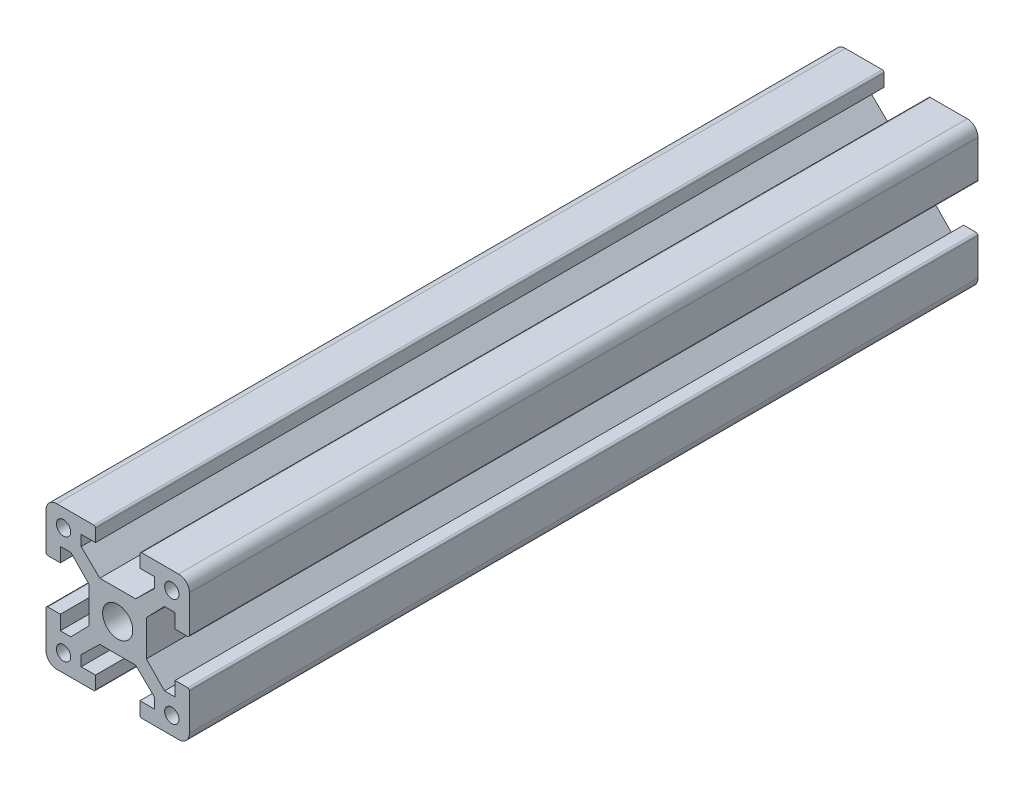
from build123d import *

# Parameters (mm, degrees)
SKETCH1_R           = 1
SKETCH1_R_2         = 2.1
BOSS_EXTRUDE2_DEPTH = 110


with BuildPart() as part:
    # Sketch1 → Boss-Extrude2 (new body)
    with BuildSketch(Plane.XY):
        with BuildLine():
            Line((-6.4, -1.5), (-6.4, -6.65))
            ThreePointArc((-6.4, -6.65), (-6.326776695, -6.826776695), (-6.15, -6.9))
            Line((-6.15, -6.9), (-4.4, -6.9))
            Line((-4.4, -6.9), (-4.4, -4.9))
            Line((-4.4, -4.9), (-2.927777778, -4.9))
            Line((-2.927777778, -4.9), (-0.4, -7.5))
            Line((-0.4, -7.5), (-0.4, -12.5))
            Line((-0.4, -12.5), (-2.927777778, -15.1))
            Line((-2.927777778, -15.1), (-4.4, -15.1))
            Line((-4.4, -15.1), (-4.4, -13.1))
            Line((-4.4, -13.1), (-6.15, -13.1))
            ThreePointArc((-6.15, -13.1), (-6.326776695, -13.173223305), (-6.4, -13.35))
            Line((-6.4, -13.35), (-6.4, -18.5))
            ThreePointArc((-6.4, -18.5), (-5.960660172, -19.560660172), (-4.9, -20))
            Line((-4.9, -20), (0.25, -20))
            ThreePointArc((0.25, -20), (0.426776695, -19.926776695), (0.5, -19.75))
            Line((0.5, -19.75), (0.5, -18))
            Line((0.5, -18), (-1.5, -18))
            Line((-1.5, -18), (-1.5, -16.527777778))
            Line((-1.5, -16.527777778), (1.1, -14))
            Line((1.1, -14), (6.1, -14))
            Line((6.1, -14), (8.7, -16.527777778))
            Line((8.7, -16.527777778), (8.7, -18))
            Line((8.7, -18), (6.7, -18))
            Line((6.7, -18), (6.7, -19.75))
            ThreePointArc((6.7, -19.75), (6.773223305, -19.926776695), (6.95, -20))
            Line((6.95, -20), (12.1, -20))
            ThreePointArc((12.1, -20), (13.160660172, -19.560660172), (13.6, -18.5))
            Line((13.6, -18.5), (13.6, -13.35))
            ThreePointArc((13.6, -13.35), (13.526776695, -13.173223305), (13.35, -13.1))
            Line((13.35, -13.1), (11.6, -13.1))
            Line((11.6, -13.1), (11.6, -15.1))
            Line((11.6, -15.1), (10.127777778, -15.1))
            Line((10.127777778, -15.1), (7.6, -12.5))
            Line((7.6, -12.5), (7.6, -7.5))
            Line((7.6, -7.5), (10.127777778, -4.9))
            Line((10.127777778, -4.9), (11.6, -4.9))
            Line((11.6, -4.9), (11.6, -6.9))
            Line((11.6, -6.9), (13.35, -6.9))
            ThreePointArc((13.35, -6.9), (13.526776695, -6.826776695), (13.6, -6.65))
            Line((13.6, -6.65), (13.6, -1.5))
            ThreePointArc((13.6, -1.5), (13.160660172, -0.439339828), (12.1, 0))
            Line((12.1, 0), (6.95, 0))
            ThreePointArc((6.95, 0), (6.773223305, -0.073223305), (6.7, -0.25))
            Line((6.7, -0.25), (6.7, -2))
            Line((6.7, -2), (8.7, -2))
            Line((8.7, -2), (8.7, -3.472222222))
            Line((8.7, -3.472222222), (6.1, -6))
            Line((6.1, -6), (1.1, -6))
            Line((1.1, -6), (-1.5, -3.472222222))
            Line((-1.5, -3.472222222), (-1.5, -2))
            Line((-1.5, -2), (0.5, -2))
            Line((0.5, -2), (0.5, -0.25))
            ThreePointArc((0.5, -0.25), (0.426776695, -0.073223305), (0.25, 0))
            Line((0.25, 0), (-4.9, 0))
            ThreePointArc((-4.9, 0), (-5.960660172, -0.439339828), (-6.4, -1.5))
        make_face()
        with Locations((-3.95, -2.45)):
            Circle(SKETCH1_R, mode=Mode.SUBTRACT)
        with Locations((11.15, -2.45)):
            Circle(SKETCH1_R, mode=Mode.SUBTRACT)
        with Locations((-3.95, -17.55)):
            Circle(SKETCH1_R, mode=Mode.SUBTRACT)
        with Locations((11.15, -17.55)):
            Circle(SKETCH1_R, mode=Mode.SUBTRACT)
        with Locations((3.6, -10)):
            Circle(SKETCH1_R_2, mode=Mode.SUBTRACT)
    extrude(amount=BOSS_EXTRUDE2_DEPTH)


solid = part.part
